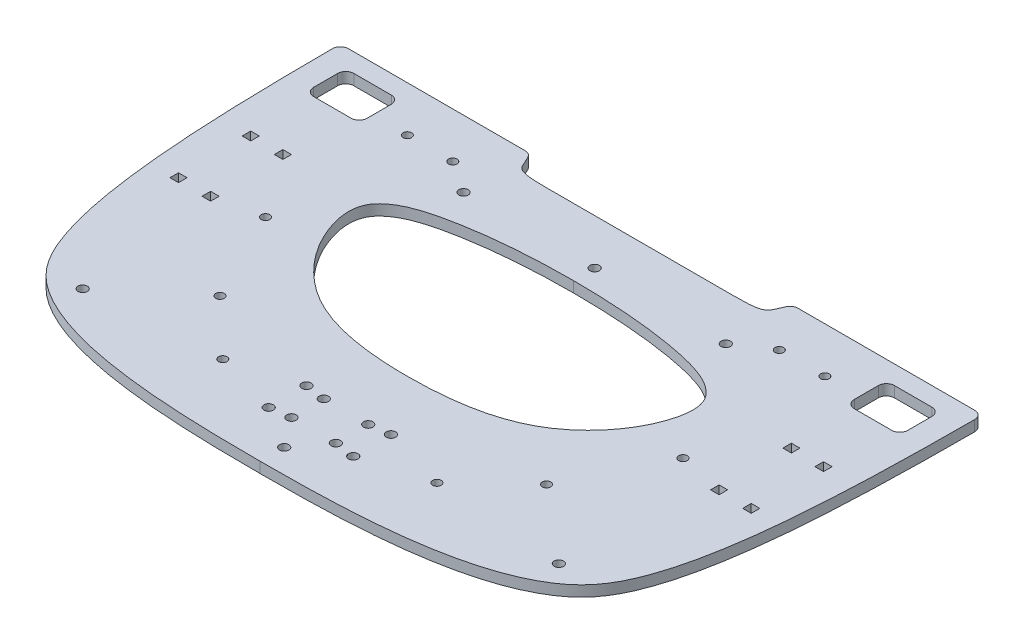
from build123d import *

# Parameters (mm, degrees)
SKETCH1_W           = 240
SKETCH1_H           = 310
BOSS_EXTRUDE1_DEPTH = 4
CUT_EXTRUDE1_REACH  = 198.064
SKETCH2_R           = 1.75
SKETCH3_R           = 1.75
CUT_EXTRUDE2_DEPTH  = 197.06376528
SKETCH4_R           = 1.75
CUT_EXTRUDE3_DEPTH  = 197.06184897
SKETCH5_R           = 1.6
CUT_EXTRUDE4_DEPTH  = 197.06184897
CUT_EXTRUDE5_DEPTH  = 197.06184897
SKETCH8_R           = 1.75
CUT_EXTRUDE7_DEPTH  = 197.06184897
FILLET1_R           = 3
CUT_EXTRUDE9_DEPTH  = 197.058343884
SKETCH14_R          = 1.6
CUT_EXTRUDE10_DEPTH = 197.058343884
SKETCH15_W          = 3.2
SKETCH15_H          = 3.2
CUT_EXTRUDE11_DEPTH = 197.058343884


with BuildPart() as part:
    # Sketch1 → Boss-Extrude1 (new body)
    with BuildSketch(Plane(origin=(0, 0, 0), x_dir=(1, 0, 0), z_dir=(0, 1, 0))):
        Rectangle(SKETCH1_W, SKETCH1_H)
    extrude(amount=BOSS_EXTRUDE1_DEPTH)

    # Sketch2 → Cut-Extrude1 (cut, up to next)
    with BuildSketch(Plane(origin=(0, 4, 0), x_dir=(1, 0, 0), z_dir=(0, 1, 0)), mode=Mode.PRIVATE) as cut_extrude1_sk1:
        with BuildLine():
            Line((-120, 155), (-120, 0))
            add(Edge.make_bspline(
                [(0, 155), (-30.572222193, 155), (-80.343316982, 153.733320995), (-119.221157946, 117.654395612), (-120, 45.41001223), (-120, 0)],
                knots=[0, 0, 0, 0, 0.458017491, 0.558017491, 1, 1, 1, 1], degree=3))
            Line((0, 155), (-120, 155))
        make_face()
    cut_extrude1_tool1 = extrude(cut_extrude1_sk1.sketch, amount=-CUT_EXTRUDE1_REACH, mode=Mode.PRIVATE) & part.part
    # Sketch2 → Cut-Extrude1 (cut, up to next)
    with BuildSketch(Plane(origin=(0, 4, 0), x_dir=(1, 0, 0), z_dir=(0, 1, 0)), mode=Mode.PRIVATE) as cut_extrude1_sk2:
        with BuildLine():
            add(Edge.make_bspline(
                [(0, 155), (30.572222193, 155), (80.343316982, 153.733320995), (119.221157946, 117.654395612), (120, 45.41001223), (120, 0)],
                knots=[0, 0, 0, 0, 0.458017491, 0.558017491, 1, 1, 1, 1], degree=3))
            Line((120, 0), (120, 155))
            Line((120, 155), (0, 155))
        make_face()
    cut_extrude1_tool2 = extrude(cut_extrude1_sk2.sketch, amount=-CUT_EXTRUDE1_REACH, mode=Mode.PRIVATE) & part.part
    # Sketch2 → Cut-Extrude1 (cut, up to next)
    with BuildSketch(Plane(origin=(0, 4, 0), x_dir=(1, 0, 0), z_dir=(0, 1, 0)), mode=Mode.PRIVATE) as cut_extrude1_sk3:
        with BuildLine():
            Line((120, -155), (120, 0))
            add(Edge.make_bspline(
                [(0, -155), (30.572222193, -155), (80.343316982, -153.733320995), (119.221157946, -117.654395612), (120, -45.41001223), (120, 0)],
                knots=[0, 0, 0, 0, 0.458017491, 0.558017491, 1, 1, 1, 1], degree=3))
            Line((0, -155), (120, -155))
        make_face()
    cut_extrude1_tool3 = extrude(cut_extrude1_sk3.sketch, amount=-CUT_EXTRUDE1_REACH, mode=Mode.PRIVATE) & part.part
    # Sketch2 → Cut-Extrude1 (cut, up to next)
    with BuildSketch(Plane(origin=(0, 4, 0), x_dir=(1, 0, 0), z_dir=(0, 1, 0)), mode=Mode.PRIVATE) as cut_extrude1_sk4:
        with BuildLine():
            add(Edge.make_bspline(
                [(0, -155), (-30.572222193, -155), (-80.343316982, -153.733320995), (-119.221157946, -117.654395612), (-120, -45.41001223), (-120, 0)],
                knots=[0, 0, 0, 0, 0.458017491, 0.558017491, 1, 1, 1, 1], degree=3))
            Line((-120, 0), (-120, -155))
            Line((-120, -155), (0, -155))
        make_face()
    cut_extrude1_tool4 = extrude(cut_extrude1_sk4.sketch, amount=-CUT_EXTRUDE1_REACH, mode=Mode.PRIVATE) & part.part
    # Sketch2 → Cut-Extrude1 (cut, up to next)
    with BuildSketch(Plane(origin=(0, 4, 0), x_dir=(1, 0, 0), z_dir=(0, 1, 0)), mode=Mode.PRIVATE) as cut_extrude1_sk5:
        with Locations(Location((-88.957037006, 132.338171163, 0), (0, 0, 270))):
            Circle(SKETCH2_R)
    cut_extrude1_tool5 = extrude(cut_extrude1_sk5.sketch, amount=-CUT_EXTRUDE1_REACH, mode=Mode.PRIVATE) & part.part
    # Sketch2 → Cut-Extrude1 (cut, up to next)
    with BuildSketch(Plane(origin=(0, 4, 0), x_dir=(1, 0, 0), z_dir=(0, 1, 0)), mode=Mode.PRIVATE) as cut_extrude1_sk6:
        with Locations(Location((0, 146, 0), (0, 0, 270))):
            Circle(SKETCH2_R)
    cut_extrude1_tool6 = extrude(cut_extrude1_sk6.sketch, amount=-CUT_EXTRUDE1_REACH, mode=Mode.PRIVATE) & part.part
    # Sketch2 → Cut-Extrude1 (cut, up to next)
    with BuildSketch(Plane(origin=(0, 4, 0), x_dir=(1, 0, 0), z_dir=(0, 1, 0)), mode=Mode.PRIVATE) as cut_extrude1_sk7:
        with Locations(Location((88.957037006, 132.338171163, 0), (0, 0, 270))):
            Circle(SKETCH2_R)
    cut_extrude1_tool7 = extrude(cut_extrude1_sk7.sketch, amount=-CUT_EXTRUDE1_REACH, mode=Mode.PRIVATE) & part.part
    # Sketch2 → Cut-Extrude1 (cut, up to next)
    with BuildSketch(Plane(origin=(0, 4, 0), x_dir=(1, 0, 0), z_dir=(0, 1, 0)), mode=Mode.PRIVATE) as cut_extrude1_sk8:
        with Locations(Location((-110.418476952, 44.934472183, 0), (0, 0, 270))):
            Circle(SKETCH2_R)
    cut_extrude1_tool8 = extrude(cut_extrude1_sk8.sketch, amount=-CUT_EXTRUDE1_REACH, mode=Mode.PRIVATE) & part.part
    # Sketch2 → Cut-Extrude1 (cut, up to next)
    with BuildSketch(Plane(origin=(0, 4, 0), x_dir=(1, 0, 0), z_dir=(0, 1, 0)), mode=Mode.PRIVATE) as cut_extrude1_sk9:
        with Locations(Location((-49, -30, 0), (0, 0, 270))):
            Circle(SKETCH2_R)
    cut_extrude1_tool9 = extrude(cut_extrude1_sk9.sketch, amount=-CUT_EXTRUDE1_REACH, mode=Mode.PRIVATE) & part.part
    # Sketch2 → Cut-Extrude1 (cut, up to next)
    with BuildSketch(Plane(origin=(0, 4, 0), x_dir=(1, 0, 0), z_dir=(0, 1, 0)), mode=Mode.PRIVATE) as cut_extrude1_sk10:
        with Locations(Location((49, -30, 0), (0, 0, 270))):
            Circle(SKETCH2_R)
    cut_extrude1_tool10 = extrude(cut_extrude1_sk10.sketch, amount=-CUT_EXTRUDE1_REACH, mode=Mode.PRIVATE) & part.part
    # Sketch2 → Cut-Extrude1 (cut, up to next)
    with BuildSketch(Plane(origin=(0, 4, 0), x_dir=(1, 0, 0), z_dir=(0, 1, 0)), mode=Mode.PRIVATE) as cut_extrude1_sk11:
        with Locations(Location((-88.957037006, -132.338171163, 0), (0, 0, 270))):
            Circle(SKETCH2_R)
    cut_extrude1_tool11 = extrude(cut_extrude1_sk11.sketch, amount=-CUT_EXTRUDE1_REACH, mode=Mode.PRIVATE) & part.part
    # Sketch2 → Cut-Extrude1 (cut, up to next)
    with BuildSketch(Plane(origin=(0, 4, 0), x_dir=(1, 0, 0), z_dir=(0, 1, 0)), mode=Mode.PRIVATE) as cut_extrude1_sk12:
        with Locations(Location((0, -146, 0), (0, 0, 270))):
            Circle(SKETCH2_R)
    cut_extrude1_tool12 = extrude(cut_extrude1_sk12.sketch, amount=-CUT_EXTRUDE1_REACH, mode=Mode.PRIVATE) & part.part
    # Sketch2 → Cut-Extrude1 (cut, up to next)
    with BuildSketch(Plane(origin=(0, 4, 0), x_dir=(1, 0, 0), z_dir=(0, 1, 0)), mode=Mode.PRIVATE) as cut_extrude1_sk13:
        with Locations(Location((88.957037006, -132.338171163, 0), (0, 0, 270))):
            Circle(SKETCH2_R)
    cut_extrude1_tool13 = extrude(cut_extrude1_sk13.sketch, amount=-CUT_EXTRUDE1_REACH, mode=Mode.PRIVATE) & part.part
    # Sketch2 → Cut-Extrude1 (cut, up to next)
    with BuildSketch(Plane(origin=(0, 4, 0), x_dir=(1, 0, 0), z_dir=(0, 1, 0)), mode=Mode.PRIVATE) as cut_extrude1_sk14:
        with Locations(Location((110.418476952, 44.934472183, 0), (0, 0, 270))):
            Circle(SKETCH2_R)
    cut_extrude1_tool14 = extrude(cut_extrude1_sk14.sketch, amount=-CUT_EXTRUDE1_REACH, mode=Mode.PRIVATE) & part.part
    add(cut_extrude1_tool1.solids().sort_by_distance((-102.173006, 4, -133.115769))[0], mode=Mode.SUBTRACT)
    add(cut_extrude1_tool2.solids().sort_by_distance((102.087926, 4, -133.133004))[0], mode=Mode.SUBTRACT)
    add(cut_extrude1_tool3.solids().sort_by_distance((102.087926, 4, 133.133004))[0], mode=Mode.SUBTRACT)
    add(cut_extrude1_tool4.solids().sort_by_distance((-102.173006, 4, 133.115769))[0], mode=Mode.SUBTRACT)
    add(cut_extrude1_tool5.solids().sort_by_distance((-88.957037, 4, -132.338171))[0], mode=Mode.SUBTRACT)
    add(cut_extrude1_tool6.solids().sort_by_distance((0, 4, -146))[0], mode=Mode.SUBTRACT)
    add(cut_extrude1_tool7.solids().sort_by_distance((88.957037, 4, -132.338171))[0], mode=Mode.SUBTRACT)
    add(cut_extrude1_tool8.solids().sort_by_distance((-110.418477, 4, -44.934472))[0], mode=Mode.SUBTRACT)
    add(cut_extrude1_tool9.solids().sort_by_distance((-49, 4, 30))[0], mode=Mode.SUBTRACT)
    add(cut_extrude1_tool10.solids().sort_by_distance((49, 4, 30))[0], mode=Mode.SUBTRACT)
    add(cut_extrude1_tool11.solids().sort_by_distance((-88.957037, 4, 132.338171))[0], mode=Mode.SUBTRACT)
    add(cut_extrude1_tool12.solids().sort_by_distance((0, 4, 146))[0], mode=Mode.SUBTRACT)
    add(cut_extrude1_tool13.solids().sort_by_distance((88.957037, 4, 132.338171))[0], mode=Mode.SUBTRACT)
    add(cut_extrude1_tool14.solids().sort_by_distance((110.418477, 4, -44.934472))[0], mode=Mode.SUBTRACT)

    # Sketch3 → Cut-Extrude2 (cut, through all)
    # profile 1 of 2: a face of its own
    with BuildSketch(Plane(origin=(0, 4, 0), x_dir=(1, 0, 0), z_dir=(0, 1, 0))):
        with BuildLine():
            Line((120, 0), (-120, 0))
            add(Edge.make_bspline(
                [(-120, 0), (-120, -1.649620662), (-119.999161826, -3.317063079), (-119.996868981, -5)],
                knots=[0, 0, 0, 0, 0.016056007, 0.016056007, 0.016056007, 0.016056007], degree=3))
            Line((-119.996868981, -5), (119.996868981, -5))
            add(Edge.make_bspline(
                [(119.996868981, -5), (119.999161826, -3.317063079), (120, -1.649620662), (120, 0)],
                knots=[0.983943993, 0.983943993, 0.983943993, 0.983943993, 1, 1, 1, 1], degree=3))
        make_face()
    # profile 2 of 2: a face of its own
    with BuildSketch(Plane(origin=(0, 4, 0), x_dir=(1, 0, 0), z_dir=(0, 1, 0))):
        with BuildLine():
            Line((-120, 0), (120, 0))
            add(Edge.make_bspline(
                [(120, 0), (120, 45.41001223), (119.221157946, 117.654395612), (80.343316982, 153.733320995), (30.572222193, 155), (0, 155)],
                knots=[0, 0, 0, 0, 0.441982509, 0.541982509, 1, 1, 1, 1], degree=3))
            add(Edge.make_bspline(
                [(0, 155), (-30.572222193, 155), (-80.343316982, 153.733320995), (-119.221157946, 117.654395612), (-120, 45.41001223), (-120, 0)],
                knots=[0, 0, 0, 0, 0.458017491, 0.558017491, 1, 1, 1, 1], degree=3))
        make_face()
        with Locations((110.418476952, 44.934472183)):
            Circle(SKETCH3_R, mode=Mode.SUBTRACT)
        with Locations((0, 146)):
            Circle(SKETCH3_R, mode=Mode.SUBTRACT)
        with Locations((-88.957037006, 132.338171163)):
            Circle(SKETCH3_R, mode=Mode.SUBTRACT)
        with Locations((-110.418476952, 44.934472183)):
            Circle(SKETCH3_R, mode=Mode.SUBTRACT)
        with Locations((88.957037006, 132.338171163)):
            Circle(SKETCH3_R, mode=Mode.SUBTRACT)
    extrude(amount=-CUT_EXTRUDE2_DEPTH, mode=Mode.SUBTRACT)

    # Sketch4 → Cut-Extrude3 (cut, through all)
    with BuildSketch(Plane(origin=(0, 4, 0), x_dir=(1, 0, 0), z_dir=(0, 1, 0))):
        with Locations(Location((0, -30, 0), (0, 0, 270))):
            Circle(SKETCH4_R)
    extrude(amount=-CUT_EXTRUDE3_DEPTH, mode=Mode.SUBTRACT)

    # Sketch5 → Cut-Extrude4 (cut, through all)
    with BuildSketch(Plane(origin=(0, 4, 0), x_dir=(1, 0, 0), z_dir=(0, 1, 0))):
        with Locations(Location((-61, -108.999999999, 0), (0, 0, 270))):
            Circle(SKETCH5_R)
        with Locations(Location((-61, -21.999999999, 0), (0, 0, 270))):
            Circle(SKETCH5_R)
        with Locations(Location((61, -22, 0), (0, 0, 270))):
            Circle(SKETCH5_R)
        with Locations(Location((61, -109, 0), (0, 0, 270))):
            Circle(SKETCH5_R)
        with BuildLine():
            Line((-51, -4.999999999), (51, -4.999999999))
            add(Edge.make_bspline(
                [(51, -4.999999999), (49.129635358, -4.999999999), (47.569011078, -8.0005268), (47.376387634, -8.775390708), (45.540706521, -12.653742164), (41.68256642, -12.999999999), (34.542577711, -12.999999999)],
                knots=[0, 0, 0, 0, 0.228374011, 0.487299701, 0.5644623, 1, 1, 1, 1], degree=3))
            Line((34.542577711, -12.999999999), (-34.542577711, -12.999999999))
            add(Edge.make_bspline(
                [(-51, -4.999999999), (-49.129635358, -4.999999999), (-47.569011078, -8.0005268), (-47.376387634, -8.775390708), (-45.540706521, -12.653742164), (-41.68256642, -12.999999999), (-34.542577711, -12.999999999)],
                knots=[0, 0, 0, 0, 0.228374011, 0.487299701, 0.5644623, 1, 1, 1, 1], degree=3))
        make_face()
    extrude(amount=-CUT_EXTRUDE4_DEPTH, mode=Mode.SUBTRACT)

    # Sketch6 → Cut-Extrude5 (cut, through all)
    with BuildSketch(Plane(origin=(0, 4, 0), x_dir=(1, 0, 0), z_dir=(0, 1, 0))):
        with BuildLine():
            add(Edge.make_bspline(
                [(0, -37.999999999), (-12.450752094, -37.999999999), (-30.689118986, -38.969591878), (-50.22157285, -43.370024939), (-57.865658077, -46.305561809), (-66.31863453, -54.257905938), (-62.773209765, -68.026537664), (-54.373147371, -81.480565894), (-35.75248125, -98.07851213), (-12.638341611, -99.999999999), (0, -99.999999999)],
                knots=[0, 0, 0, 0, 0.264131069, 0.321740627, 0.388216858, 0.419341791, 0.536423737, 0.607786801, 0.734444613, 1, 1, 1, 1], degree=3))
            add(Edge.make_bspline(
                [(0, -37.999999999), (12.450752094, -37.999999999), (30.689118986, -38.969591878), (50.22157285, -43.370024939), (57.865658077, -46.305561809), (66.31863453, -54.257905938), (62.773209765, -68.026537664), (54.373147371, -81.480565894), (35.75248125, -98.07851213), (12.638341611, -99.999999999), (0, -99.999999999)],
                knots=[0, 0, 0, 0, 0.264131069, 0.321740627, 0.388216858, 0.419341791, 0.536423737, 0.607786801, 0.734444613, 1, 1, 1, 1], degree=3))
        make_face()
    extrude(amount=-CUT_EXTRUDE5_DEPTH, mode=Mode.SUBTRACT)

    # Sketch8 → Cut-Extrude7 (cut, through all)
    with BuildSketch(Plane(origin=(0, 4, 0), x_dir=(1, 0, 0), z_dir=(0, 1, 0))):
        with Locations(Location((-8.3, -122.9, 0), (0, 0, 270))):
            Circle(SKETCH8_R)
        with Locations(Location((8.3, -122.9, 0), (0, 0, 90))):
            Circle(SKETCH8_R)
        with Locations(Location((8.3, -135, 0), (0, 0, 270))):
            Circle(SKETCH8_R)
        with Locations(Location((-8.3, -135, 0), (0, 0, 90))):
            Circle(SKETCH8_R)
        with Locations(Location((-15.8, -121.9, 0), (0, 0, 270))):
            Circle(SKETCH8_R)
        with Locations(Location((-15.8, -136, 0), (0, 0, 270))):
            Circle(SKETCH8_R)
        with Locations(Location((15.8, -136, 0), (0, 0, 270))):
            Circle(SKETCH8_R)
        with Locations(Location((15.8, -121.9, 0), (0, 0, 270))):
            Circle(SKETCH8_R)
    extrude(amount=-CUT_EXTRUDE7_DEPTH, mode=Mode.SUBTRACT)

    # Fillet1
    fillet1_edges = [part.edges().sort_by_distance(p)[0] for p in [
        (-119.996868981, 2, 5),
        (119.996868981, 2, 5),
    ]]
    fillet(fillet1_edges, radius=FILLET1_R)

    # Sketch13 → Cut-Extrude9 (cut, through all)
    with BuildSketch(Plane(origin=(0, 4, 0), x_dir=(1, 0, 0), z_dir=(0, 1, 0))):
        with BuildLine():
            Line((94, -12), (108, -12))
            ThreePointArc((108, -12), (110.121320344, -12.878679656), (111, -15))
            Line((111, -15), (111, -24))
            ThreePointArc((111, -24), (110.121320344, -26.121320344), (108, -27))
            Line((108, -27), (94, -27))
            ThreePointArc((94, -27), (91.878679656, -26.121320344), (91, -24))
            Line((91, -24), (91, -15))
            ThreePointArc((91, -15), (91.878679656, -12.878679656), (94, -12))
        make_face()
        with BuildLine():
            Line((-94, -27), (-108, -27))
            ThreePointArc((-108, -27), (-110.121320344, -26.121320344), (-111, -24))
            Line((-111, -24), (-111, -15))
            ThreePointArc((-111, -15), (-110.121320344, -12.878679656), (-108, -12))
            Line((-108, -12), (-94, -12))
            ThreePointArc((-94, -12), (-91.878679656, -12.878679656), (-91, -15))
            Line((-91, -15), (-91, -24))
            ThreePointArc((-91, -24), (-91.878679656, -26.121320344), (-94, -27))
        make_face()
    extrude(amount=-CUT_EXTRUDE9_DEPTH, mode=Mode.SUBTRACT)

    # Sketch14 → Cut-Extrude10 (cut, through all)
    with BuildSketch(Plane(origin=(0, 4, 0), x_dir=(1, 0, 0), z_dir=(0, 1, 0))):
        with Locations(Location((78, -75, 0), (0, 0, 270))):
            Circle(SKETCH14_R)
        with Locations(Location((78, -22, 0), (0, 0, 270))):
            Circle(SKETCH14_R)
        with Locations(Location((40, -128.95, 0), (0, 0, 270))):
            Circle(SKETCH14_R)
        with Locations(Location((-40, -128.95, 0), (0, 0, 90))):
            Circle(SKETCH14_R)
        with Locations(Location((-78, -75, 0), (0, 0, 90))):
            Circle(SKETCH14_R)
        with Locations(Location((-78, -22, 0), (0, 0, 90))):
            Circle(SKETCH14_R)
    extrude(amount=-CUT_EXTRUDE10_DEPTH, mode=Mode.SUBTRACT)

    # Sketch15 → Cut-Extrude11 (cut, through all)
    with BuildSketch(Plane(origin=(0, 4, 0), x_dir=(1, 0, 0), z_dir=(0, 1, 0))):
        with Locations((95, -51.5)):
            Rectangle(SKETCH15_W, SKETCH15_H)
        with Locations((107, -51.5)):
            Rectangle(SKETCH15_W, SKETCH15_H)
        with Locations((95, -78.5)):
            Rectangle(SKETCH15_W, SKETCH15_H)
        with Locations((107, -78.5)):
            Rectangle(SKETCH15_W, SKETCH15_H)
        with Locations((-107, -78.5)):
            Rectangle(SKETCH15_W, SKETCH15_H)
        with Locations((-95, -78.5)):
            Rectangle(SKETCH15_W, SKETCH15_H)
        with Locations((-95, -51.5)):
            Rectangle(SKETCH15_W, SKETCH15_H)
        with Locations((-107, -51.5)):
            Rectangle(SKETCH15_W, SKETCH15_H)
    extrude(amount=-CUT_EXTRUDE11_DEPTH, mode=Mode.SUBTRACT)


solid = part.part
